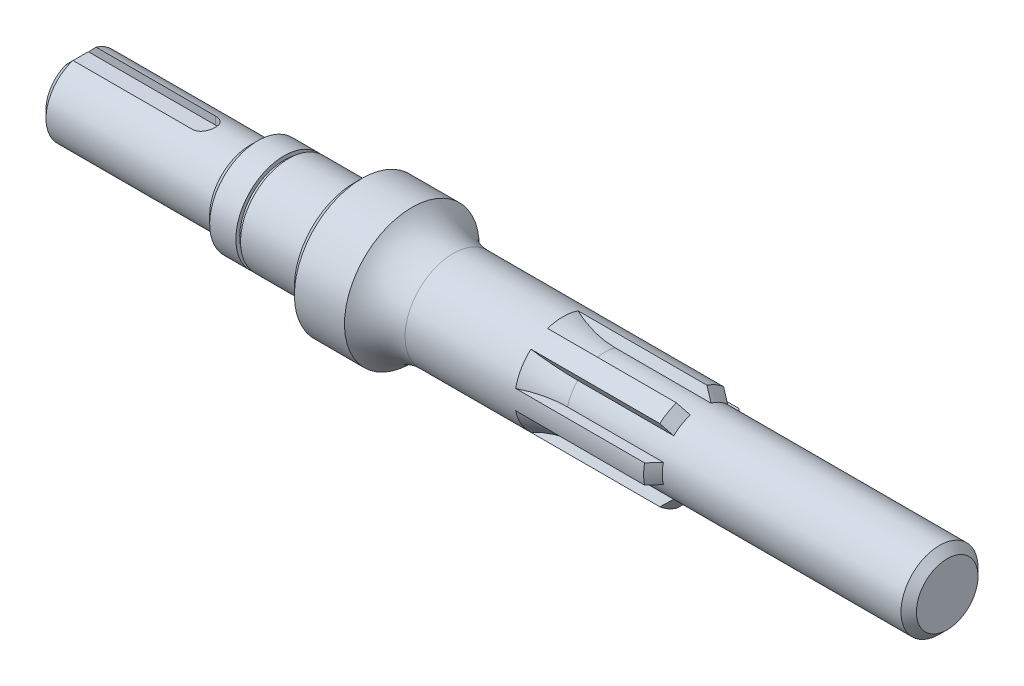
from build123d import *
from build123d.topology import SkipClean

# Parameters (mm, degrees)
EXTRUDE_START            = 27
SKETCH_2_R               = 12.5
EXTRUDE_1_DEPTH          = 27
EXTRUDE_START_2          = 45
SKETCH_3_R               = 10
EXTRUDE_2_DEPTH          = 45
CUT_EXTRUDE_START        = -8.8
SKETCH_5_OUTSIDE_W       = 83.272
SKETCH_5_OUTSIDE_H       = 83.272
SKETCH_5_OUTSIDE_R       = 11.5
CUT_EXTRUDE_1_DEPTH      = 1.2
CUT_EXTRUDE_START_2      = 7.5
CUT_EXTRUDE_2_DEPTH      = 220.851050141
EXTRUDE_3_REACH          = 293.351
EXTRUDE_START_3          = -64
PATTERN_CIRCULAR_1_COUNT = 6
CHAMFER_1_SIZE           = 2


with BuildPart() as part:
    # 草图1 → 旋转1 (revolve)
    with BuildSketch(Plane.XY):
        with BuildLine():
            Line((0, 0), (0, 10))
            Line((0, 10), (-88.902752641, 10))
            ThreePointArc((-88.902752641, 10), (-94.492922585, 10.633014138), (-99.8, 12.5))
            Line((-99.8, 12.5), (-128.276194705, 12.5))
            ThreePointArc((-128.276194705, 12.5), (-134.192274488, 13.81142246), (-139, 17.5))
            Line((-139, 17.5), (-154, 17.5))
            Line((-154, 17.5), (-154, 0))
            Line((-154, 0), (0, 0))
        make_face()
    revolve(axis=Axis((0, 0, 0), (-1, 0, 0)))

    # 草图2 → 凸台-拉伸1 (add)
    with BuildSketch(Plane.ZY.offset(154).offset(EXTRUDE_START)):
        with Locations(Location((0, 0, 0), (0, 0, 90))):
            Circle(SKETCH_2_R)
    extrude(amount=-EXTRUDE_1_DEPTH)

    # 草图3 → 凸台-拉伸2 (add)
    with BuildSketch(Plane.ZY.offset(181).offset(EXTRUDE_START_2)):
        with Locations(Location((0, 0, 0), (0, 0, 90))):
            Circle(SKETCH_3_R)
    extrude(amount=-EXTRUDE_2_DEPTH)

    # 草图5 outside → 切除-拉伸1 (cut)
    with BuildSketch(Plane.ZY.offset(181).offset(CUT_EXTRUDE_START)):
        Rectangle(SKETCH_5_OUTSIDE_W, SKETCH_5_OUTSIDE_H)
        with Locations(Location((0, 0, 0), (0, 0, 270))):
            Circle(SKETCH_5_OUTSIDE_R, mode=Mode.SUBTRACT)
    extrude(amount=-CUT_EXTRUDE_1_DEPTH, mode=Mode.SUBTRACT)

    # 草图7 → 切除-拉伸2 (cut, through all)
    with BuildSketch(Plane(origin=(0, 0, 0), x_dir=(1, 0, 0), z_dir=(0, 1, 0)).offset(CUT_EXTRUDE_START_2)):
        with BuildLine():
            Line((-226, 3), (-193, 3))
            ThreePointArc((-193, 3), (-190, 0), (-193, -3))
            Line((-193, -3), (-226, -3))
            ThreePointArc((-226, -3), (-229, 0), (-226, 3))
        make_face()
    extrude(amount=CUT_EXTRUDE_2_DEPTH, mode=Mode.SUBTRACT)

    # 草图8 → 凸台-拉伸3 (add, up to next)
    with BuildSketch(Plane(origin=(0, 0, 0), x_dir=(0, 0, -1), z_dir=(1, 0, 0)).offset(EXTRUDE_START_3), mode=Mode.PRIVATE) as extrude_3_sk1:
        with BuildLine():
            Line((12.247448714, 2.5), (9.682458366, 2.5))
            ThreePointArc((9.682458366, 2.5), (10, 0), (9.682458366, -2.5))
            Line((9.682458366, -2.5), (12.247448714, -2.5))
            ThreePointArc((12.247448714, -2.5), (12.5, 0), (12.247448714, 2.5))
        make_face()
    extrude_3_tool1 = extrude(extrude_3_sk1.sketch, amount=-EXTRUDE_3_REACH, mode=Mode.PRIVATE) - part.part
    extrude_3 = extrude_3_tool1.solids().sort_by_distance((-64, 0, -11.154849))[0]
    add(extrude_3)

    # 阵列(圆周)1: 凸台-拉伸3 ×6 about axis
    with SkipClean():  # the faces are left unmerged after this step: merging them gives an invalid solid
        pattern_circular_1_axis = Axis((0, 0, 0), (1, 0, 0))
        for i in range(1, PATTERN_CIRCULAR_1_COUNT):
            add(extrude_3.rotate(pattern_circular_1_axis, i * 360 / PATTERN_CIRCULAR_1_COUNT))

    # 草图9 → 切除-旋转1 (revolve, cut)
    with BuildSketch(Plane(origin=(0, 0, 0), x_dir=(1, 0, 0), z_dir=(0, 1, 0)), mode=Mode.PRIVATE) as cut_revolve_1_sk:
        Polygon((-64, 10), (-64, 12.5), (-66.329579642, 12.5), align=None)
    revolve(cut_revolve_1_sk.sketch.rotate(Axis((0, 0, 0), (1, 0, 0)), 270), axis=Axis((0, 0, 0), (1, 0, 0)), mode=Mode.SUBTRACT)

    # 倒角1
    chamfer_1_edges = [part.edges().sort_by_distance(p)[0] for p in [
        (-226, -10, 0),
        (-181, -12.5, 0),
        (-154, -17.5, 0),
        (0, -10, 0),
    ]]
    chamfer(chamfer_1_edges, length=CHAMFER_1_SIZE)


solid = part.part
